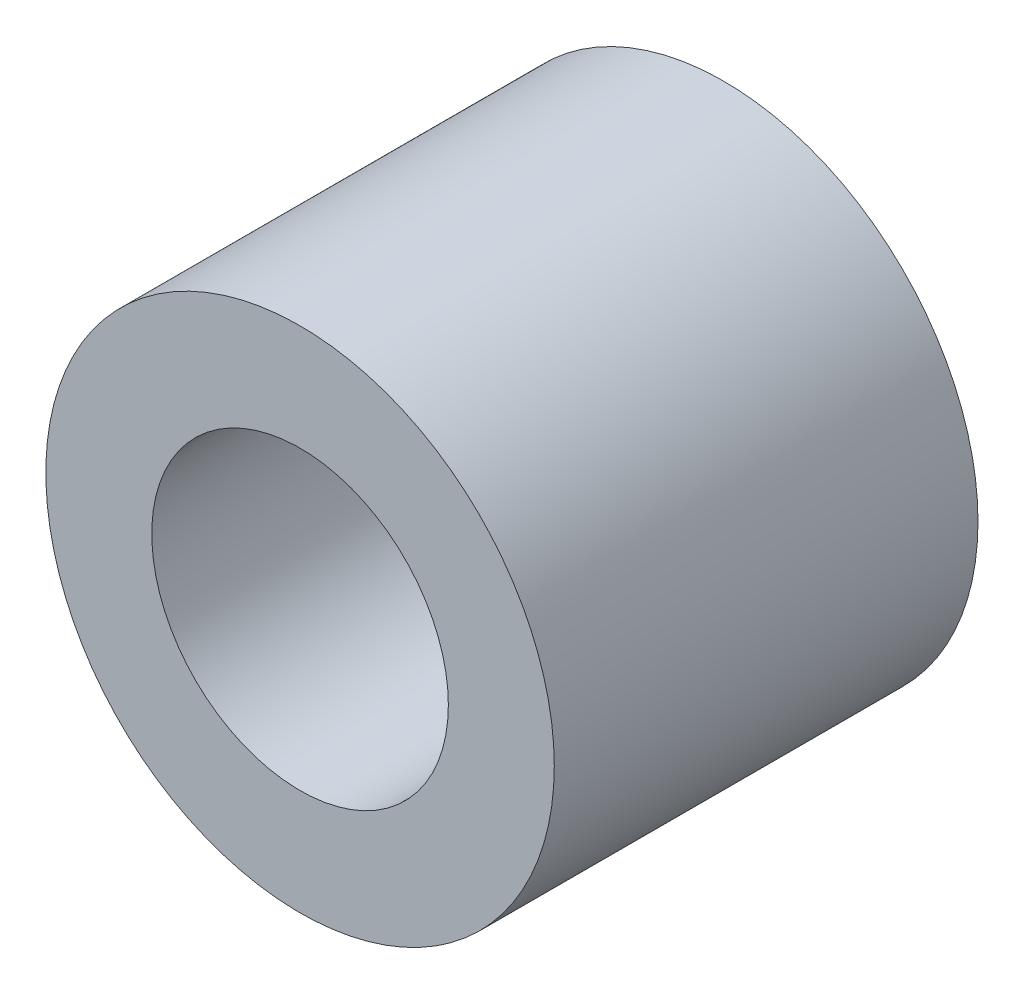
from build123d import *

# Parameters (mm, degrees)
SKETCH_1_R      = 6
SKETCH_1_R_2    = 3.5
EXTRUDE_1_DEPTH = 10


with BuildPart() as part:
    # 草图1 → 凸台-拉伸1 (new body)
    with BuildSketch(Plane.XY):
        Circle(SKETCH_1_R)
        Circle(SKETCH_1_R_2, mode=Mode.SUBTRACT)
    extrude(amount=EXTRUDE_1_DEPTH)


solid = part.part
